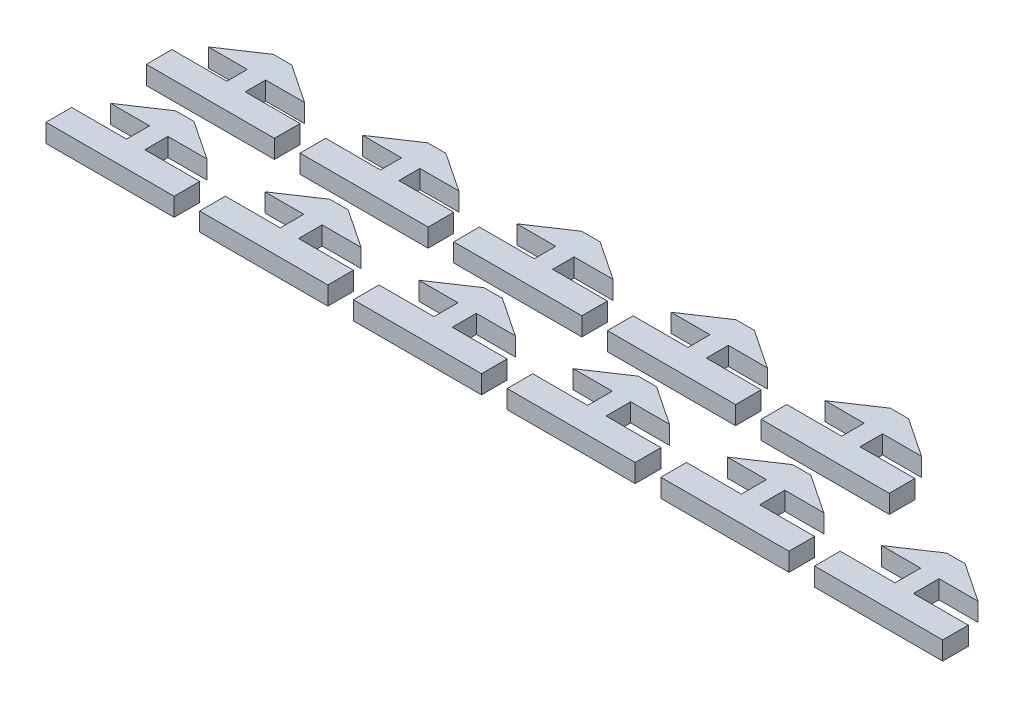
from build123d import *

# Parameters (mm, degrees)
BOSS_EXTRUDE1_DEPTH = 3.5814
BOSS_EXTRUDE2_DEPTH = 3.5814


with BuildPart() as part:
    # Sketch1 → Boss-Extrude1 (new body)
    with BuildSketch(Plane(origin=(0, 0, 0), x_dir=(1, 0, 0), z_dir=(0, 1, 0))):
        Polygon((-12.5, -7), (12.5, -7), (12.5, -2), (1.7907, -2), (1.7907, 2), (9.398, 2), (1.7907, 7.08), (-1.7907, 7.08), (-9.398, 2), (-1.7907, 2), (-1.7907, -2), (-12.5, -2), align=None)
    extrude(amount=BOSS_EXTRUDE1_DEPTH)


with BuildPart() as body_2:
    # Sketch2 → Boss-Extrude2 (new body)
    with BuildSketch(Plane(origin=(0, 0, 0), x_dir=(1, 0, 0), z_dir=(0, 1, 0))):
        Polygon((17.5, -2), (28.2093, -2), (28.2093, 2.1), (20.602, 2.1), (28.2093, 7.18), (31.7907, 7.18), (39.398, 2.1), (31.7907, 2.1), (31.7907, -2), (42.5, -2), (42.5, -7), (17.5, -7), align=None)
        Polygon((47.5, -7), (72.5, -7), (72.5, -2), (61.7907, -2), (61.7907, 2.2), (69.398, 2.2), (61.7907, 7.28), (58.2093, 7.28), (50.602, 2.2), (58.2093, 2.2), (58.2093, -2), (47.5, -2), align=None)
        Polygon((77.5, -7), (102.5, -7), (102.5, -2), (91.7907, -2), (91.7907, 2.3), (99.398, 2.3), (91.7907, 7.38), (88.2093, 7.38), (80.602, 2.3), (88.2093, 2.3), (88.2093, -2), (77.5, -2), align=None)
        Polygon((107.5, -7), (132.5, -7), (132.5, -2), (121.7907, -2), (121.7907, 2.4), (129.398, 2.4), (121.7907, 7.48), (118.2093, 7.48), (110.602, 2.4), (118.2093, 2.4), (118.2093, -2), (107.5, -2), align=None)
        Polygon((-12.5, -26.58), (12.5, -26.58), (12.5, -21.58), (1.7907, -21.58), (1.7907, -17.08), (9.398, -17.08), (1.7907, -12), (-1.7907, -12), (-9.398, -17.08), (-1.7907, -17.08), (-1.7907, -21.58), (-12.5, -21.58), align=None)
        Polygon((31.7907, -21.58), (28.2093, -21.58), (17.5, -21.58), (17.5, -26.58), (42.5, -26.58), (42.5, -21.58), align=None)
        Polygon((61.7907, -21.58), (58.2093, -21.58), (47.5, -21.58), (47.5, -26.58), (72.5, -26.58), (72.5, -21.58), align=None)
        Polygon((20.602, -16.98), (28.2093, -16.98), (28.2093, -21.58), (31.7907, -21.58), (31.7907, -16.98), (39.398, -16.98), (31.7907, -11.9), (28.2093, -11.9), align=None)
        Polygon((50.602, -16.88), (58.2093, -16.88), (58.2093, -21.58), (61.7907, -21.58), (61.7907, -16.88), (69.398, -16.88), (61.7907, -11.8), (58.2093, -11.8), align=None)
        Polygon((77.5, -26.58), (102.5, -26.58), (102.5, -21.58), (91.7907, -21.58), (91.7907, -16.78), (99.398, -16.78), (91.7907, -11.7), (88.2093, -11.7), (80.602, -16.78), (88.2093, -16.78), (88.2093, -21.58), (77.5, -21.58), align=None)
        Polygon((107.5, -26.58), (132.5, -26.58), (132.5, -21.58), (121.7907, -21.58), (121.7907, -16.68), (129.398, -16.68), (121.7907, -11.6), (118.2093, -11.6), (110.602, -16.68), (118.2093, -16.68), (118.2093, -21.58), (107.5, -21.58), align=None)
        Polygon((137.5, -26.58), (162.5, -26.58), (162.5, -21.58), (151.7907, -21.58), (151.7907, -16.58), (159.398, -16.58), (151.7907, -11.5), (148.2093, -11.5), (140.602, -16.58), (148.2093, -16.58), (148.2093, -21.58), (137.5, -21.58), align=None)
    extrude(amount=BOSS_EXTRUDE2_DEPTH)


solid = Compound([part.part, body_2.part])
